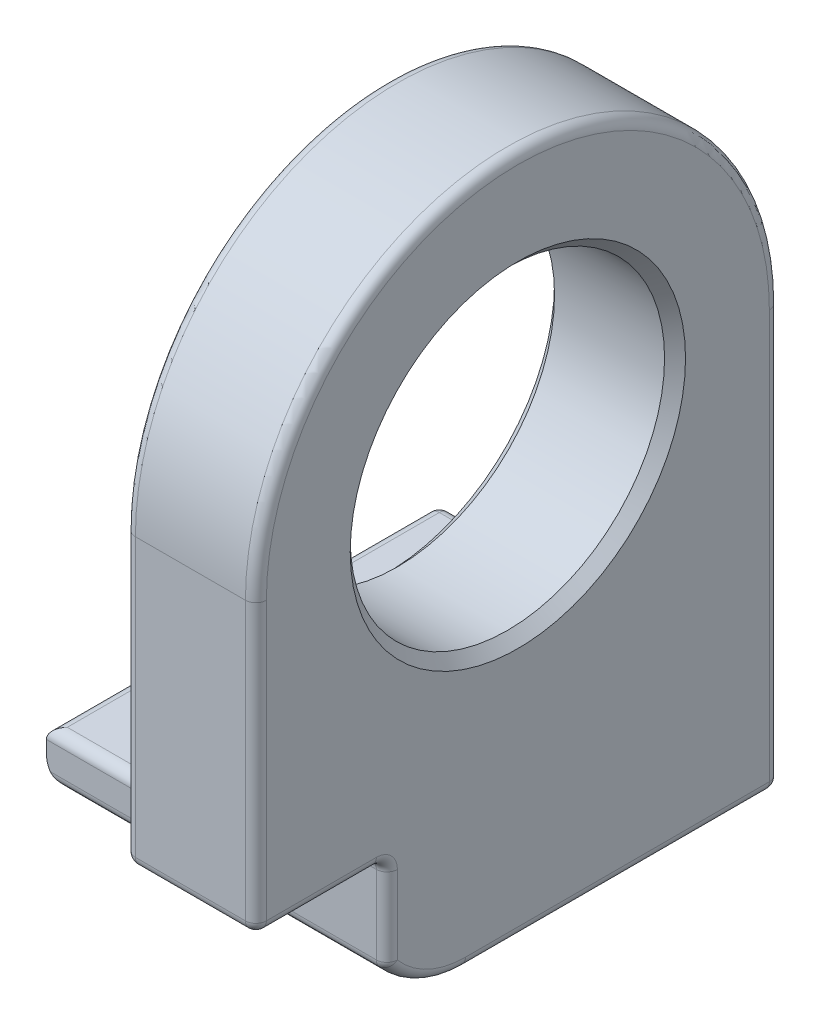
from build123d import *

# Parameters (mm, degrees)
SKETCH_1_R          = 3
EXTRUDE_1_DEPTH     = 2.5
SKETCH_2_W          = 6.5
SKETCH_2_H          = 10
SKETCH_2_R          = 0.8
EXTRUDE_2_DEPTH     = 1.5
SKETCH_5_W          = 6.5
SKETCH_5_H          = 2.5
CUT_EXTRUDE_1_DEPTH = 2.5
CUT_EXTRUDE_2_REACH = 13.456
FILLET_1_R          = 0.2
FILLET_2_R          = 0.2
CHAMFER_1_SIZE      = 0.2


with BuildPart() as part:
    # 草图1 → 凸台-拉伸1 (new body)
    with BuildSketch(Plane(origin=(0, 0, 0), x_dir=(0, 0, -1), z_dir=(1, 0, 0))):
        with BuildLine():
            Line((-5, 0), (-5, -8))
            Line((-5, -8), (5, -8))
            Line((5, -8), (5, 0))
            ThreePointArc((5, 0), (0, 5), (-5, 0))
        make_face()
        Circle(SKETCH_1_R, mode=Mode.SUBTRACT)
    extrude(amount=EXTRUDE_1_DEPTH)

    # 草图2 → 凸台-拉伸2 (add)
    with BuildSketch(Plane.XZ.offset(8)):
        with Locations((-0.75, 0)):
            Rectangle(SKETCH_2_W, SKETCH_2_H)
        with Locations(Location((-2, 0.5, 0), (0, 0, 270))):
            Circle(SKETCH_2_R, mode=Mode.SUBTRACT)
        with Locations(Location((-2, -3, 0), (0, 0, 270))):
            Circle(SKETCH_2_R, mode=Mode.SUBTRACT)
    extrude(amount=-EXTRUDE_2_DEPTH)

    # 草图5 → 切除-拉伸1 (cut)
    with BuildSketch(Plane.XZ.offset(8)):
        with Locations((-0.75, 3.75)):
            Rectangle(SKETCH_5_W, SKETCH_5_H)
    extrude(amount=-CUT_EXTRUDE_1_DEPTH, mode=Mode.SUBTRACT)

    # 草图6 → 切除-拉伸2 (cut, up to next)
    with BuildSketch(Plane.ZY.offset(4), mode=Mode.PRIVATE) as cut_extrude_2_sk1:
        with BuildLine():
            Line((2.897366596, -6), (3.27705392, -6))
            Line((3.27705392, -6), (3.27705392, -8.325127743))
            Line((3.27705392, -8.325127743), (1, -8.325127743))
            Line((1, -8.325127743), (1, -8))
            ThreePointArc((1, -8), (2.378404875, -7.407669683), (2.897366596, -6))
        make_face()
    cut_extrude_2_tool1 = extrude(cut_extrude_2_sk1.sketch, amount=-CUT_EXTRUDE_2_REACH, mode=Mode.PRIVATE) & part.part
    add(cut_extrude_2_tool1.solids().sort_by_distance((-4, -7.575754, 2.569334))[0], mode=Mode.SUBTRACT)

    # 圆角1
    fillet_1_edges = [part.edges().sort_by_distance(p)[0] for p in [
        (0, -6.5, -1.25),
    ]]
    fillet(fillet_1_edges, radius=FILLET_1_R)

    # 圆角2
    fillet_2_edges = [part.edges().sort_by_distance(p)[0] for p in [
        (2.5, -4, -5),
        (-2.1, -6.5, -5),
        (-4, -7.25, -5),
        (2.5, 5, 0),
        (-4, -6.5, -1.25),
        (1.25, -5.5, 5),
        (-2.1, -6.5, 2.5),
        (1.25, -5.5, 2.5),
        (2.5, -6.383095189, 2.5),
        (2.5, -5.5, 3.75),
        (0, -5.5, 3.75),
        (0, -2.75, 5),
        (0, 5, 0),
        (-4, -8, -2),
        (2.5, -8, -2),
        (-0.75, -7.266190379, 2.5),
        (2.5, -7.806716397, 1.834936608),
        (-4, -7.806716397, 1.834936608),
        (2.5, -2.75, 5),
        (-0.75, -8, -5),
        (0, -5.9, 2.5),
        (0, -3.15, -5),
        (-0.058578644, -6.441421356, -5),
        (-0.058578644, -6.441421356, 2.5),
    ]]
    fillet(fillet_2_edges, radius=FILLET_2_R)

    # 倒角1
    chamfer_1_edges = [part.edges().sort_by_distance(p)[0] for p in [
        (0, 0, 3),
        (2.5, 0, 3),
    ]]
    chamfer(chamfer_1_edges, length=CHAMFER_1_SIZE)


solid = part.part
